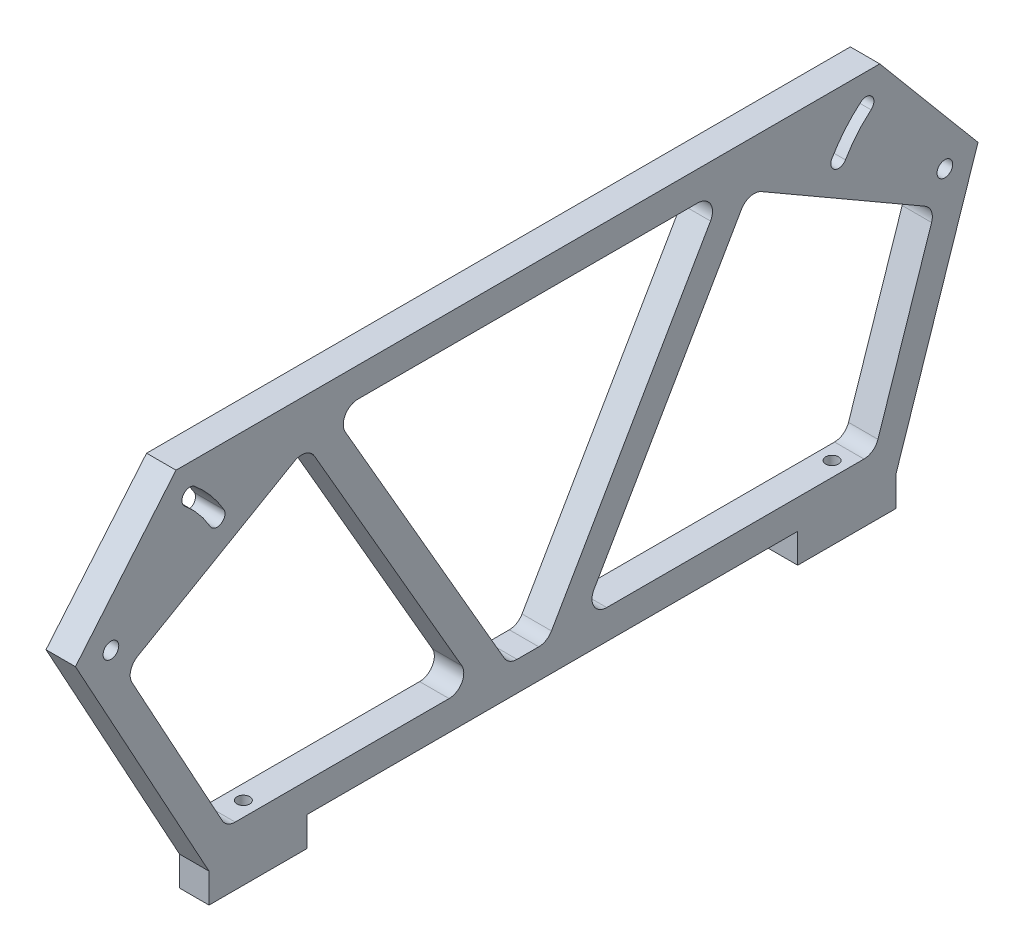
from build123d import *

# Parameters (mm, degrees)
SKETCH1_R           = 1.6
BOSS_EXTRUDE1_DEPTH = 6
FILLET1_R           = 3
CUT_EXTRUDE1_REACH  = 124.34
SKETCH2_R           = 1.3


with BuildPart() as part:
    # Sketch1 → Boss-Extrude1 (new body)
    with BuildSketch(Plane(origin=(0, 0, 0), x_dir=(0, 0, -1), z_dir=(1, 0, 0))):
        Polygon((-65, 0), (-45, 0), (-45, 6), (55, 6), (55, 0), (75, 0), (75, 6), (91.752837084, 56.286625106), (71.728155707, 80.151111078), (-71.728155707, 80.151111078), (-92.232725383, 55.714716502), (-65, 6), align=None)
        with Locations((-85, 55)):
            Circle(SKETCH1_R, mode=Mode.SUBTRACT)
        with Locations((85, 55)):
            Circle(SKETCH1_R, mode=Mode.SUBTRACT)
        Polygon((-82.116733572, 49.736451418), (-45.025455014, 71.151111078), (-10.874545111, 12), (-61.445461749, 12), align=None, mode=Mode.SUBTRACT)
        Polygon((-39.829302592, 74.151111078), (39.829302592, 74.151111078), (3.94634188, 12), (-3.94634188, 12), align=None, mode=Mode.SUBTRACT)
        Polygon((45.025455014, 71.151111078), (83.06422235, 49.189418517), (70.674680035, 12), (10.874545111, 12), align=None, mode=Mode.SUBTRACT)
        with BuildLine():
            ThreePointArc((-61.963724259, 68.3), (-64.623217813, 72.098150418), (-67.901849582, 75.376782187))
            ThreePointArc((-67.901849582, 75.376782187), (-70.155980867, 75.179571253), (-69.958769933, 72.925439969))
            ThreePointArc((-69.958769933, 72.925439969), (-67.074560031, 70.041230067), (-64.735005551, 66.7))
            ThreePointArc((-64.735005551, 66.7), (-62.549364905, 66.114359354), (-61.963724259, 68.3))
        make_face(mode=Mode.SUBTRACT)
        with BuildLine():
            ThreePointArc((67.901849582, 75.376782187), (64.623217813, 72.098150418), (61.963724259, 68.3))
            ThreePointArc((61.963724259, 68.3), (62.549364905, 66.114359354), (64.735005551, 66.7))
            ThreePointArc((64.735005551, 66.7), (67.074560031, 70.041230067), (69.958769933, 72.925439969))
            ThreePointArc((69.958769933, 72.925439969), (70.155980867, 75.179571253), (67.901849582, 75.376782187))
        make_face(mode=Mode.SUBTRACT)
    extrude(amount=BOSS_EXTRUDE1_DEPTH)

    # Fillet1
    fillet1_edges = [part.edges().sort_by_distance(p)[0] for p in [
        (3, 49.736451418, 82.116733572),
        (3, 12, 61.445461749),
        (3, 12, 10.874545111),
        (3, 71.151111078, 45.025455014),
        (3, 74.151111078, 39.829302592),
        (3, 12, 3.94634188),
        (3, 12, -3.94634188),
        (3, 74.151111078, -39.829302592),
        (3, 71.151111078, -45.025455014),
        (3, 12, -10.874545111),
        (3, 12, -70.674680035),
        (3, 49.189418517, -83.06422235),
    ]]
    fillet(fillet1_edges, radius=FILLET1_R)

    # Sketch2 → Cut-Extrude1 (cut, up to next)
    with BuildSketch(Plane.XZ, mode=Mode.PRIVATE) as cut_extrude1_sk1:
        with Locations(Location((3, 55, 0), (0, 0, 270))):
            Circle(SKETCH2_R)
    cut_extrude1_tool1 = extrude(cut_extrude1_sk1.sketch, amount=-CUT_EXTRUDE1_REACH, mode=Mode.PRIVATE) & part.part
    # Sketch2 → Cut-Extrude1 (cut, up to next)
    with BuildSketch(Plane.XZ, mode=Mode.PRIVATE) as cut_extrude1_sk2:
        with Locations(Location((3, -65, 0), (0, 0, 270))):
            Circle(SKETCH2_R)
    cut_extrude1_tool2 = extrude(cut_extrude1_sk2.sketch, amount=-CUT_EXTRUDE1_REACH, mode=Mode.PRIVATE) & part.part
    add(cut_extrude1_tool1.solids().sort_by_distance((3, 0, 55))[0], mode=Mode.SUBTRACT)
    add(cut_extrude1_tool2.solids().sort_by_distance((3, 0, -65))[0], mode=Mode.SUBTRACT)


solid = part.part
